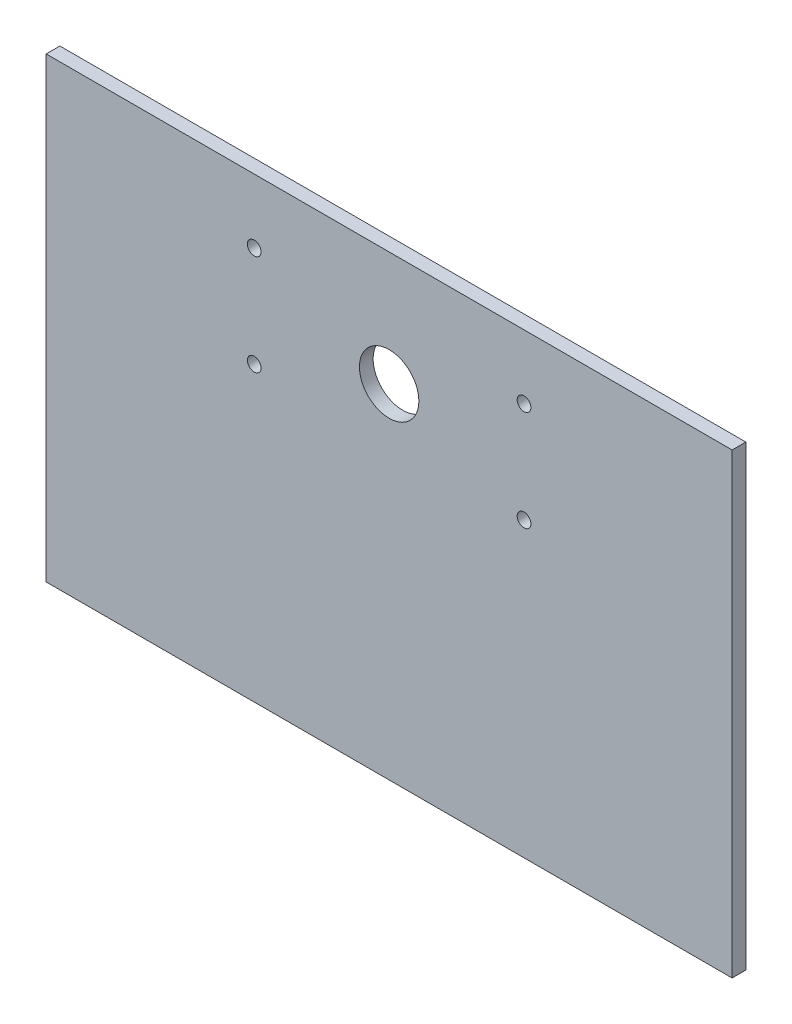
from build123d import *

# Parameters (mm, degrees)
ESBO_O1_W                = 150
ESBO_O1_H                = 100
ESBO_O1_R                = 6.5
ESBO_O1_R_2              = 1.5
RESSALTO_EXTRUS_O1_DEPTH = 3


with BuildPart() as part:
    # Esboço1 → Ressalto-extrusão1 (new body)
    with BuildSketch(Plane.XY):
        with Locations((75, 50)):
            Rectangle(ESBO_O1_W, ESBO_O1_H)
        with Locations((75, 75)):
            Circle(ESBO_O1_R, mode=Mode.SUBTRACT)
        with Locations((104.5, 86)):
            Circle(ESBO_O1_R_2, mode=Mode.SUBTRACT)
        with Locations(Location((104.5, 64, 0), (0, 0, 180))):
            Circle(ESBO_O1_R_2, mode=Mode.SUBTRACT)
        with Locations((45.5, 64)):
            Circle(ESBO_O1_R_2, mode=Mode.SUBTRACT)
        with Locations(Location((45.5, 86, 0), (0, 0, 180))):
            Circle(ESBO_O1_R_2, mode=Mode.SUBTRACT)
    extrude(amount=RESSALTO_EXTRUS_O1_DEPTH)


solid = part.part
